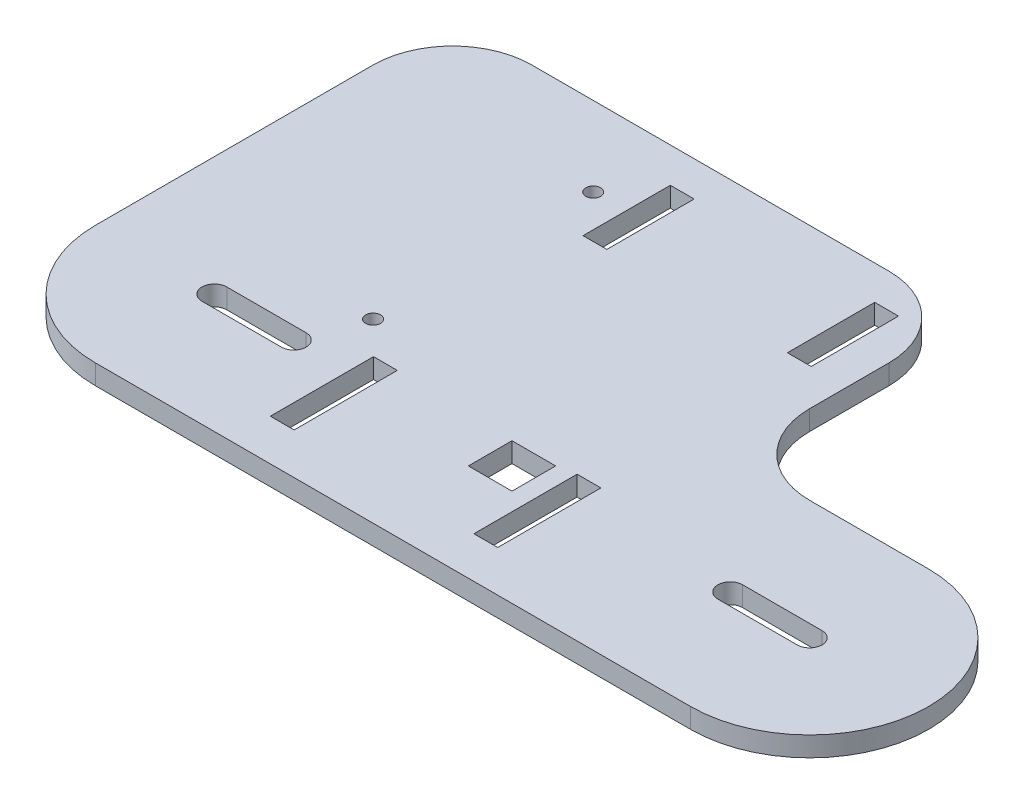
from build123d import *

# Parameters (mm, degrees)
SKETCH1_W           = 13.97
SKETCH1_H           = 13.97
BOSS_EXTRUDE1_DEPTH = 6.35
SKETCH4_W           = 7.62
SKETCH4_H           = 33.02
SKETCH4_H_2         = 27.94
CUT_EXTRUDE1_DEPTH  = 176.747076789
SKETCH5_R           = 2.38125
CUT_EXTRUDE2_DEPTH  = 176.747076789


with BuildPart() as part:
    # Sketch1 → Boss-Extrude1 (new body)
    with BuildSketch(Plane(origin=(0, 0, 0), x_dir=(1, 0, 0), z_dir=(0, 1, 0))):
        with BuildLine():
            Line((-95.25, -38.1), (95.25, -38.1))
            ThreePointArc((95.25, -38.1), (133.35, 0), (95.25, 38.1))
            Line((95.25, 38.1), (57.15, 38.1))
            ThreePointArc((57.15, 38.1), (39.189487758, 45.539487758), (31.75, 63.5))
            Line((31.75, 63.5), (31.75, 88.9))
            ThreePointArc((31.75, 88.9), (24.310512242, 106.860512242), (6.35, 114.3))
            Line((6.35, 114.3), (-107.95, 114.3))
            ThreePointArc((-107.95, 114.3), (-125.910512242, 106.860512242), (-133.35, 88.9))
            Line((-133.35, 88.9), (-133.35, 0))
            ThreePointArc((-133.35, 0), (-122.190768363, -26.940768363), (-95.25, -38.1))
        make_face()
        Rectangle(SKETCH1_W, SKETCH1_H, mode=Mode.SUBTRACT)
        with BuildLine():
            Line((95.25, -3.96875), (69.85, -3.96875))
            ThreePointArc((69.85, -3.96875), (65.88125, 0), (69.85, 3.96875))
            Line((69.85, 3.96875), (95.25, 3.96875))
            ThreePointArc((95.25, 3.96875), (99.21875, 0), (95.25, -3.96875))
        make_face(mode=Mode.SUBTRACT)
        with BuildLine():
            Line((-95.25, -3.96875), (-69.85, -3.96875))
            ThreePointArc((-69.85, -3.96875), (-65.88125, 0), (-69.85, 3.96875))
            Line((-69.85, 3.96875), (-95.25, 3.96875))
            ThreePointArc((-95.25, 3.96875), (-99.21875, 0), (-95.25, -3.96875))
        make_face(mode=Mode.SUBTRACT)
    extrude(amount=BOSS_EXTRUDE1_DEPTH)

    # Sketch4 → Cut-Extrude1 (cut, through all)
    with BuildSketch(Plane(origin=(0, 6.35, 0), x_dir=(1, 0, 0), z_dir=(0, 1, 0))):
        with Locations((16.51, -8.382)):
            Rectangle(SKETCH4_W, SKETCH4_H)
        with Locations((-48.641, -8.382)):
            Rectangle(SKETCH4_W, SKETCH4_H)
        with Locations((16.51, 89.408)):
            Rectangle(SKETCH4_W, SKETCH4_H_2)
        with Locations((-48.641, 89.154)):
            Rectangle(SKETCH4_W, SKETCH4_H_2)
    extrude(amount=-CUT_EXTRUDE1_DEPTH, mode=Mode.SUBTRACT)

    # Sketch5 → Cut-Extrude2 (cut, through all)
    with BuildSketch(Plane(origin=(0, 6.35, 0), x_dir=(1, 0, 0), z_dir=(0, 1, 0))):
        with Locations(Location((-62.9158, 88.9, 0), (0, 0, 270))):
            Circle(SKETCH5_R)
        with Locations(Location((-62.9158, 18.455847939, 0), (0, 0, 270))):
            Circle(SKETCH5_R)
    extrude(amount=-CUT_EXTRUDE2_DEPTH, mode=Mode.SUBTRACT)


solid = part.part
